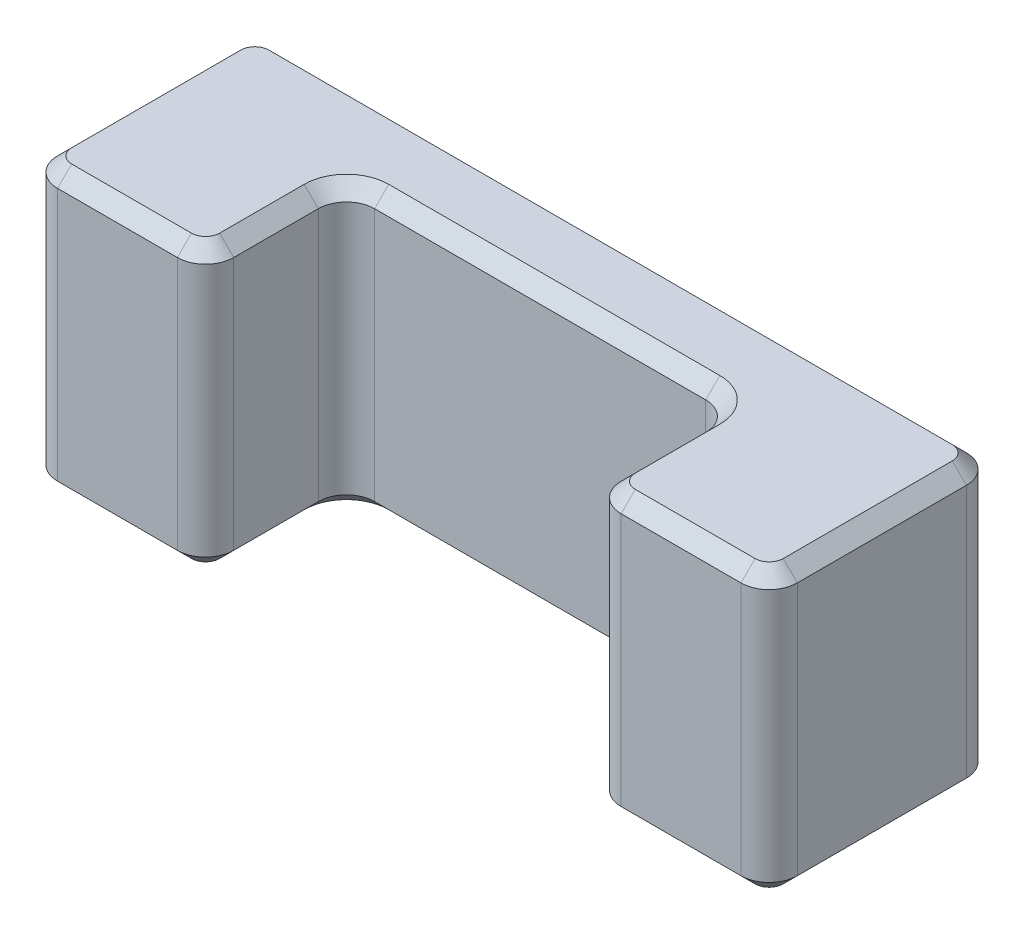
from build123d import *

# Parameters (mm, degrees)
BOSS_EXTRUDE1_DEPTH = 10
FILLET1_R           = 1
CHAMFER1_SIZE       = 0.5


with BuildPart() as part:
    # Sketch1 → Boss-Extrude1 (new body)
    with BuildSketch(Plane(origin=(0, 0, 0), x_dir=(1, 0, 0), z_dir=(0, 1, 0))):
        Polygon((-13.125, 0), (-13.125, -5), (-6.875, -5), (-6.875, 0), (6.875, 0), (6.875, -5), (13.125, -5), (13.125, 0), (13.125, 3), (-13.125, 3), align=None)
    extrude(amount=BOSS_EXTRUDE1_DEPTH)

    # Fillet1
    fillet1_edges = [part.edges().sort_by_distance(p)[0] for p in [
        (-6.875, 5, 0),
        (-6.875, 5, 5),
        (-13.125, 5, 5),
        (-13.125, 5, -3),
        (13.125, 5, -3),
        (13.125, 5, 5),
        (6.875, 5, 5),
        (6.875, 5, 0),
    ]]
    fillet(fillet1_edges, radius=FILLET1_R)

    # Chamfer1
    chamfer1_edges = [part.edges().sort_by_distance(p)[0] for p in [
        (0, 0, -3),
        (0, 10, -3),
        (0, 0, 0),
        (-6.875, 0, 2.5),
        (-10, 0, 5),
        (-13.125, 0, 1),
        (13.125, 0, 1),
        (10, 0, 5),
        (6.875, 0, 2.5),
        (-12.832106781, 0, 4.707106781),
        (-7.167893219, 0, 4.707106781),
        (-12.832106781, 0, -2.707106781),
        (7.167893219, 0, 4.707106781),
        (12.832106781, 0, 4.707106781),
        (12.832106781, 0, -2.707106781),
        (13.125, 10, 1),
        (0, 10, 0),
        (6.875, 10, 2.5),
        (10, 10, 5),
        (-13.125, 10, 1),
        (-10, 10, 5),
        (-6.875, 10, 2.5),
        (-12.832106781, 10, 4.707106781),
        (-7.167893219, 10, 4.707106781),
        (-12.832106781, 10, -2.707106781),
        (7.167893219, 10, 4.707106781),
        (12.832106781, 10, 4.707106781),
        (12.832106781, 10, -2.707106781),
        (6.582106781, 0, 0.292893219),
        (6.582106781, 10, 0.292893219),
        (-6.582106781, 0, 0.292893219),
        (-6.582106781, 10, 0.292893219),
    ]]
    chamfer(chamfer1_edges, length=CHAMFER1_SIZE)


solid = part.part
